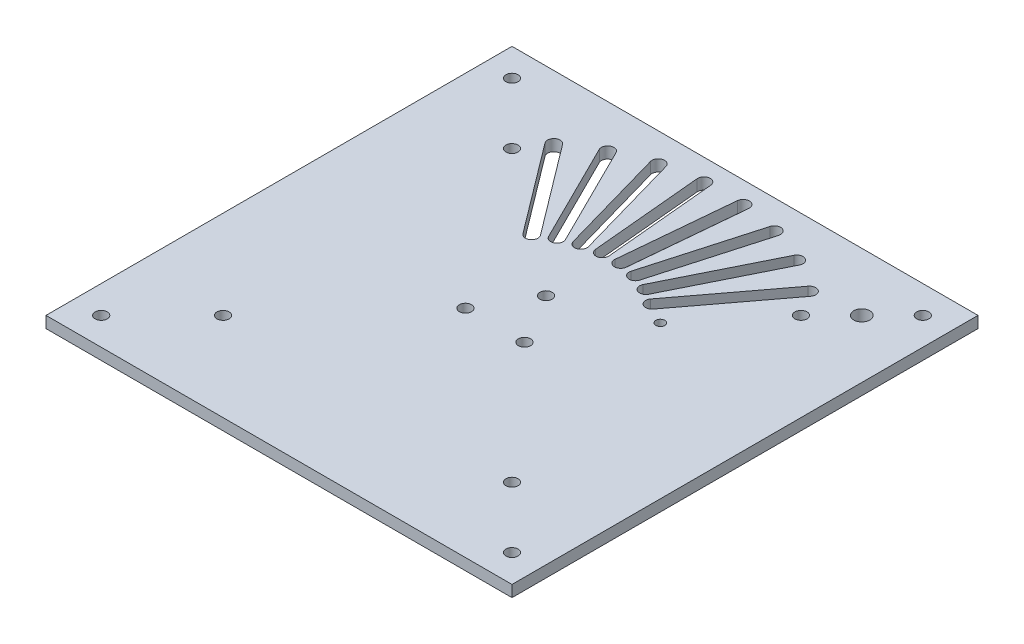
from build123d import *

# Parameters (mm, degrees)
SKETCH2_W                 = 130
SKETCH2_H                 = 130
BOSS_EXTRUDE1_DEPTH       = 3.2
CUT_EXTRUDE1_REACH        = 93.98
SKETCH4_R                 = 1.7
CUT_EXTRUDE2_REACH        = 93.98
SKETCH6_R                 = 1.7
CUT_EXTRUDE3_REACH        = 93.98
SKETCH8_R                 = 1.7
PRIMARY_WIRE_HOLE_REACH   = 93.98
SKETCH9_R                 = 2.25
SECONDARY_WIRE_HOLE_REACH = 93.98
SKETCH10_R                = 1.25
CUT_EXTRUDE6_REACH        = 93.98


with BuildPart() as part:
    # Sketch2 → Boss-Extrude1 (new body)
    with BuildSketch(Plane(origin=(0, 0, 0), x_dir=(1, 0, 0), z_dir=(0, 1, 0))):
        Rectangle(SKETCH2_W, SKETCH2_H)
    extrude(amount=BOSS_EXTRUDE1_DEPTH)

    # Sketch4 → Cut-Extrude1 (cut, up to next)
    with BuildSketch(Plane(origin=(0, 3.2, 0), x_dir=(1, 0, 0), z_dir=(0, 1, 0)), mode=Mode.PRIVATE) as cut_extrude1_sk1:
        with Locations(Location((-57.3, 57.3, 0), (0, 0, 270))):
            Circle(SKETCH4_R)
    cut_extrude1_tool1 = extrude(cut_extrude1_sk1.sketch, amount=-CUT_EXTRUDE1_REACH, mode=Mode.PRIVATE) & part.part
    # Sketch4 → Cut-Extrude1 (cut, up to next)
    with BuildSketch(Plane(origin=(0, 3.2, 0), x_dir=(1, 0, 0), z_dir=(0, 1, 0)), mode=Mode.PRIVATE) as cut_extrude1_sk2:
        with Locations(Location((57.3, 57.3, 0), (0, 0, 270))):
            Circle(SKETCH4_R)
    cut_extrude1_tool2 = extrude(cut_extrude1_sk2.sketch, amount=-CUT_EXTRUDE1_REACH, mode=Mode.PRIVATE) & part.part
    # Sketch4 → Cut-Extrude1 (cut, up to next)
    with BuildSketch(Plane(origin=(0, 3.2, 0), x_dir=(1, 0, 0), z_dir=(0, 1, 0)), mode=Mode.PRIVATE) as cut_extrude1_sk3:
        with Locations(Location((57.3, -57.3, 0), (0, 0, 270))):
            Circle(SKETCH4_R)
    cut_extrude1_tool3 = extrude(cut_extrude1_sk3.sketch, amount=-CUT_EXTRUDE1_REACH, mode=Mode.PRIVATE) & part.part
    # Sketch4 → Cut-Extrude1 (cut, up to next)
    with BuildSketch(Plane(origin=(0, 3.2, 0), x_dir=(1, 0, 0), z_dir=(0, 1, 0)), mode=Mode.PRIVATE) as cut_extrude1_sk4:
        with Locations(Location((-57.3, -57.3, 0), (0, 0, 270))):
            Circle(SKETCH4_R)
    cut_extrude1_tool4 = extrude(cut_extrude1_sk4.sketch, amount=-CUT_EXTRUDE1_REACH, mode=Mode.PRIVATE) & part.part
    add(cut_extrude1_tool1.solids().sort_by_distance((-57.3, 3.2, -57.3))[0], mode=Mode.SUBTRACT)
    add(cut_extrude1_tool2.solids().sort_by_distance((57.3, 3.2, -57.3))[0], mode=Mode.SUBTRACT)
    add(cut_extrude1_tool3.solids().sort_by_distance((57.3, 3.2, 57.3))[0], mode=Mode.SUBTRACT)
    add(cut_extrude1_tool4.solids().sort_by_distance((-57.3, 3.2, 57.3))[0], mode=Mode.SUBTRACT)

    # Sketch6 → Cut-Extrude2 (cut, up to next)
    with BuildSketch(Plane(origin=(0, 3.2, 0), x_dir=(1, 0, 0), z_dir=(0, 1, 0)), mode=Mode.PRIVATE) as cut_extrude2_sk1:
        with Locations(Location((-40.305086528, 40.305086528, 0), (0, 0, 270))):
            Circle(SKETCH6_R)
    cut_extrude2_tool1 = extrude(cut_extrude2_sk1.sketch, amount=-CUT_EXTRUDE2_REACH, mode=Mode.PRIVATE) & part.part
    # Sketch6 → Cut-Extrude2 (cut, up to next)
    with BuildSketch(Plane(origin=(0, 3.2, 0), x_dir=(1, 0, 0), z_dir=(0, 1, 0)), mode=Mode.PRIVATE) as cut_extrude2_sk2:
        with Locations(Location((40.305086528, 40.305086528, 0), (0, 0, 270))):
            Circle(SKETCH6_R)
    cut_extrude2_tool2 = extrude(cut_extrude2_sk2.sketch, amount=-CUT_EXTRUDE2_REACH, mode=Mode.PRIVATE) & part.part
    # Sketch6 → Cut-Extrude2 (cut, up to next)
    with BuildSketch(Plane(origin=(0, 3.2, 0), x_dir=(1, 0, 0), z_dir=(0, 1, 0)), mode=Mode.PRIVATE) as cut_extrude2_sk3:
        with Locations(Location((40.305086528, -40.305086528, 0), (0, 0, 270))):
            Circle(SKETCH6_R)
    cut_extrude2_tool3 = extrude(cut_extrude2_sk3.sketch, amount=-CUT_EXTRUDE2_REACH, mode=Mode.PRIVATE) & part.part
    # Sketch6 → Cut-Extrude2 (cut, up to next)
    with BuildSketch(Plane(origin=(0, 3.2, 0), x_dir=(1, 0, 0), z_dir=(0, 1, 0)), mode=Mode.PRIVATE) as cut_extrude2_sk4:
        with Locations(Location((-40.305086528, -40.305086528, 0), (0, 0, 270))):
            Circle(SKETCH6_R)
    cut_extrude2_tool4 = extrude(cut_extrude2_sk4.sketch, amount=-CUT_EXTRUDE2_REACH, mode=Mode.PRIVATE) & part.part
    add(cut_extrude2_tool1.solids().sort_by_distance((-40.305087, 3.2, -40.305087))[0], mode=Mode.SUBTRACT)
    add(cut_extrude2_tool2.solids().sort_by_distance((40.305087, 3.2, -40.305087))[0], mode=Mode.SUBTRACT)
    add(cut_extrude2_tool3.solids().sort_by_distance((40.305087, 3.2, 40.305087))[0], mode=Mode.SUBTRACT)
    add(cut_extrude2_tool4.solids().sort_by_distance((-40.305087, 3.2, 40.305087))[0], mode=Mode.SUBTRACT)

    # Sketch8 → Cut-Extrude3 (cut, up to next)
    with BuildSketch(Plane(origin=(0, 3.2, 0), x_dir=(1, 0, 0), z_dir=(0, 1, 0)), mode=Mode.PRIVATE) as cut_extrude3_sk1:
        with Locations(Location((0, 9.5, 0), (0, 0, 270))):
            Circle(SKETCH8_R)
    cut_extrude3_tool1 = extrude(cut_extrude3_sk1.sketch, amount=-CUT_EXTRUDE3_REACH, mode=Mode.PRIVATE) & part.part
    # Sketch8 → Cut-Extrude3 (cut, up to next)
    with BuildSketch(Plane(origin=(0, 3.2, 0), x_dir=(1, 0, 0), z_dir=(0, 1, 0)), mode=Mode.PRIVATE) as cut_extrude3_sk2:
        with Locations(Location((8.227241336, -4.75, 0), (0, 0, 270))):
            Circle(SKETCH8_R)
    cut_extrude3_tool2 = extrude(cut_extrude3_sk2.sketch, amount=-CUT_EXTRUDE3_REACH, mode=Mode.PRIVATE) & part.part
    # Sketch8 → Cut-Extrude3 (cut, up to next)
    with BuildSketch(Plane(origin=(0, 3.2, 0), x_dir=(1, 0, 0), z_dir=(0, 1, 0)), mode=Mode.PRIVATE) as cut_extrude3_sk3:
        with Locations(Location((-8.227241336, -4.75, 0), (0, 0, 270))):
            Circle(SKETCH8_R)
    cut_extrude3_tool3 = extrude(cut_extrude3_sk3.sketch, amount=-CUT_EXTRUDE3_REACH, mode=Mode.PRIVATE) & part.part
    add(cut_extrude3_tool1.solids().sort_by_distance((0, 3.2, -9.5))[0], mode=Mode.SUBTRACT)
    add(cut_extrude3_tool2.solids().sort_by_distance((8.227241, 3.2, 4.75))[0], mode=Mode.SUBTRACT)
    add(cut_extrude3_tool3.solids().sort_by_distance((-8.227241, 3.2, 4.75))[0], mode=Mode.SUBTRACT)

    # Sketch9 → Primary wire hole (cut, up to next)
    with BuildSketch(Plane(origin=(0, 3.2, 0), x_dir=(1, 0, 0), z_dir=(0, 1, 0)), mode=Mode.PRIVATE) as primary_wire_hole_sk1:
        with Locations(Location((48.790367902, 48.790367902, 0), (0, 0, 270))):
            Circle(SKETCH9_R)
    primary_wire_hole_tool1 = extrude(primary_wire_hole_sk1.sketch, amount=-PRIMARY_WIRE_HOLE_REACH, mode=Mode.PRIVATE) & part.part
    add(primary_wire_hole_tool1.solids().sort_by_distance((48.790368, 3.2, -48.790368))[0], mode=Mode.SUBTRACT)

    # Sketch10 → Secondary wire hole (cut, up to next)
    with BuildSketch(Plane(origin=(0, 3.2, 0), x_dir=(1, 0, 0), z_dir=(0, 1, 0)), mode=Mode.PRIVATE) as secondary_wire_hole_sk1:
        with Locations(Location((22.506385739, 18.885099973, 0), (0, 0, 270))):
            Circle(SKETCH10_R)
    secondary_wire_hole_tool1 = extrude(secondary_wire_hole_sk1.sketch, amount=-SECONDARY_WIRE_HOLE_REACH, mode=Mode.PRIVATE) & part.part
    add(secondary_wire_hole_tool1.solids().sort_by_distance((22.506386, 3.2, -18.8851))[0], mode=Mode.SUBTRACT)

    # Sketch11 → Cut-Extrude6 (cut, up to next)
    with BuildSketch(Plane(origin=(0, 3.2, 0), x_dir=(1, 0, 0), z_dir=(0, 1, 0)), mode=Mode.PRIVATE) as cut_extrude6_sk1:
        with BuildLine():
            Line((-34.259927979, 48.372330261), (-15.380990703, 23.319134311))
            ThreePointArc((-15.380990703, 23.319134311), (-15.725426555, 20.868345878), (-18.176214988, 21.21278173))
            Line((-18.176214988, 21.21278173), (-37.055152264, 46.26597768))
            ThreePointArc((-37.055152264, 46.26597768), (-36.710716412, 48.716766113), (-34.259927979, 48.372330261))
        make_face()
    cut_extrude6_tool1 = extrude(cut_extrude6_sk1.sketch, amount=-CUT_EXTRUDE6_REACH, mode=Mode.PRIVATE) & part.part
    # Sketch11 → Cut-Extrude6 (cut, up to next)
    with BuildSketch(Plane(origin=(0, 3.2, 0), x_dir=(1, 0, 0), z_dir=(0, 1, 0)), mode=Mode.PRIVATE) as cut_extrude6_sk2:
        with BuildLine():
            Line((-27.938203096, 52.278884913), (-13.975987518, 24.187365977))
            ThreePointArc((-13.975987518, 24.187365977), (-11.629987027, 23.399151731), (-10.841772782, 25.745152222))
            Line((-10.841772782, 25.745152222), (-24.80398836, 53.836671159))
            ThreePointArc((-24.80398836, 53.836671159), (-27.149988851, 54.624885404), (-27.938203096, 52.278884913))
        make_face()
    cut_extrude6_tool2 = extrude(cut_extrude6_sk2.sketch, amount=-CUT_EXTRUDE6_REACH, mode=Mode.PRIVATE) & part.part
    # Sketch11 → Cut-Extrude6 (cut, up to next)
    with BuildSketch(Plane(origin=(0, 3.2, 0), x_dir=(1, 0, 0), z_dir=(0, 1, 0)), mode=Mode.PRIVATE) as cut_extrude6_sk3:
        with BuildLine():
            Line((-17.87286129, 56.517128637), (-9.301329978, 26.340883824))
            ThreePointArc((-9.301329978, 26.340883824), (-7.139754963, 25.135647974), (-5.934519112, 27.297222989))
            Line((-5.934519112, 27.297222989), (-14.506050425, 57.473467801))
            ThreePointArc((-14.506050425, 57.473467801), (-16.667625439, 58.678703651), (-17.87286129, 56.517128637))
        make_face()
    cut_extrude6_tool3 = extrude(cut_extrude6_sk3.sketch, amount=-CUT_EXTRUDE6_REACH, mode=Mode.PRIVATE) & part.part
    # Sketch11 → Cut-Extrude6 (cut, up to next)
    with BuildSketch(Plane(origin=(0, 3.2, 0), x_dir=(1, 0, 0), z_dir=(0, 1, 0)), mode=Mode.PRIVATE) as cut_extrude6_sk4:
        with BuildLine():
            Line((-7.200805802, 58.836837065), (-4.310928692, 27.600231771))
            ThreePointArc((-4.310928692, 27.600231771), (-2.407156164, 26.018887355), (-0.825811748, 27.922659883))
            Line((-0.825811748, 27.922659883), (-3.715688858, 59.159265177))
            ThreePointArc((-3.715688858, 59.159265177), (-5.619461386, 60.740609593), (-7.200805802, 58.836837065))
        make_face()
    cut_extrude6_tool4 = extrude(cut_extrude6_sk4.sketch, amount=-CUT_EXTRUDE6_REACH, mode=Mode.PRIVATE) & part.part
    # Sketch11 → Cut-Extrude6 (cut, up to next)
    with BuildSketch(Plane(origin=(0, 3.2, 0), x_dir=(1, 0, 0), z_dir=(0, 1, 0)), mode=Mode.PRIVATE) as cut_extrude6_sk5:
        with BuildLine():
            Line((3.715688858, 59.159265177), (0.825811748, 27.922659883))
            ThreePointArc((0.825811748, 27.922659883), (2.407156164, 26.018887355), (4.310928692, 27.600231771))
            Line((4.310928692, 27.600231771), (7.200805802, 58.836837065))
            ThreePointArc((7.200805802, 58.836837065), (5.619461386, 60.740609593), (3.715688858, 59.159265177))
        make_face()
    cut_extrude6_tool5 = extrude(cut_extrude6_sk5.sketch, amount=-CUT_EXTRUDE6_REACH, mode=Mode.PRIVATE) & part.part
    # Sketch11 → Cut-Extrude6 (cut, up to next)
    with BuildSketch(Plane(origin=(0, 3.2, 0), x_dir=(1, 0, 0), z_dir=(0, 1, 0)), mode=Mode.PRIVATE) as cut_extrude6_sk6:
        with BuildLine():
            Line((14.506050425, 57.473467801), (5.934519112, 27.297222989))
            ThreePointArc((5.934519112, 27.297222989), (7.139754963, 25.135647974), (9.301329978, 26.340883824))
            Line((9.301329978, 26.340883824), (17.87286129, 56.517128637))
            ThreePointArc((17.87286129, 56.517128637), (16.667625439, 58.678703651), (14.506050425, 57.473467801))
        make_face()
    cut_extrude6_tool6 = extrude(cut_extrude6_sk6.sketch, amount=-CUT_EXTRUDE6_REACH, mode=Mode.PRIVATE) & part.part
    # Sketch11 → Cut-Extrude6 (cut, up to next)
    with BuildSketch(Plane(origin=(0, 3.2, 0), x_dir=(1, 0, 0), z_dir=(0, 1, 0)), mode=Mode.PRIVATE) as cut_extrude6_sk7:
        with BuildLine():
            Line((24.80398836, 53.836671159), (10.841772782, 25.745152222))
            ThreePointArc((10.841772782, 25.745152222), (11.629987027, 23.399151731), (13.975987518, 24.187365977))
            Line((13.975987518, 24.187365977), (27.938203096, 52.278884913))
            ThreePointArc((27.938203096, 52.278884913), (27.149988851, 54.624885404), (24.80398836, 53.836671159))
        make_face()
    cut_extrude6_tool7 = extrude(cut_extrude6_sk7.sketch, amount=-CUT_EXTRUDE6_REACH, mode=Mode.PRIVATE) & part.part
    # Sketch11 → Cut-Extrude6 (cut, up to next)
    with BuildSketch(Plane(origin=(0, 3.2, 0), x_dir=(1, 0, 0), z_dir=(0, 1, 0)), mode=Mode.PRIVATE) as cut_extrude6_sk8:
        with BuildLine():
            Line((34.259927979, 48.372330261), (15.380990703, 23.319134311))
            ThreePointArc((15.380990703, 23.319134311), (15.725426555, 20.868345878), (18.176214988, 21.21278173))
            Line((18.176214988, 21.21278173), (37.055152264, 46.26597768))
            ThreePointArc((37.055152264, 46.26597768), (36.710716412, 48.716766113), (34.259927979, 48.372330261))
        make_face()
    cut_extrude6_tool8 = extrude(cut_extrude6_sk8.sketch, amount=-CUT_EXTRUDE6_REACH, mode=Mode.PRIVATE) & part.part
    add(cut_extrude6_tool1.solids().sort_by_distance((-26.218071, 3.2, -34.792556))[0], mode=Mode.SUBTRACT)
    add(cut_extrude6_tool2.solids().sort_by_distance((-19.389988, 3.2, -39.012019))[0], mode=Mode.SUBTRACT)
    add(cut_extrude6_tool3.solids().sort_by_distance((-11.90369, 3.2, -41.907176))[0], mode=Mode.SUBTRACT)
    add(cut_extrude6_tool4.solids().sort_by_distance((-4.013309, 3.2, -43.379748))[0], mode=Mode.SUBTRACT)
    add(cut_extrude6_tool5.solids().sort_by_distance((4.013309, 3.2, -43.379748))[0], mode=Mode.SUBTRACT)
    add(cut_extrude6_tool6.solids().sort_by_distance((11.90369, 3.2, -41.907176))[0], mode=Mode.SUBTRACT)
    add(cut_extrude6_tool7.solids().sort_by_distance((19.389988, 3.2, -39.012019))[0], mode=Mode.SUBTRACT)
    add(cut_extrude6_tool8.solids().sort_by_distance((26.218071, 3.2, -34.792556))[0], mode=Mode.SUBTRACT)


solid = part.part
